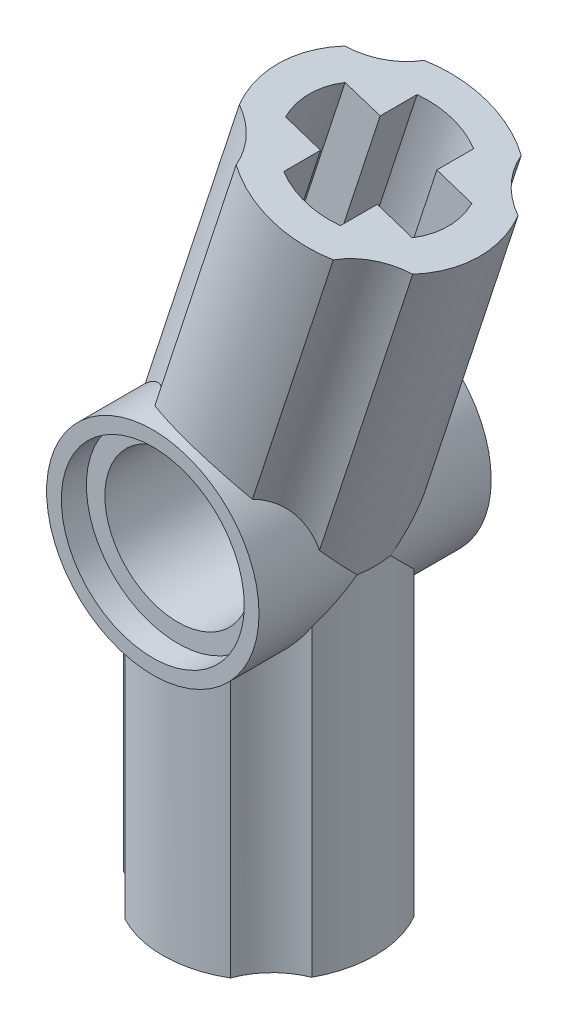
from build123d import *

# Parameters (mm, degrees)
CROQUIS1_R                   = 3.6
CROQUIS1_R_2                 = 3.1
SALIENTE_EXTRUIR1_DEPTH      = 7.87
SALIENTE_EXTRUIR2_START      = 0.85
CROQUIS1_3_R                 = 3.1
CROQUIS1_3_R_2               = 2.475
SALIENTE_EXTRUIR2_DEPTH      = 6.17
SALIENTE_EXTRUIR3_REACH      = 13.518
SALIENTE_EXTRUIR3_END_RADIUS = 3.6
SALIENTE_EXTRUIR4_START      = -8
SALIENTE_EXTRUIR4_DEPTH      = 8
SALIENTE_EXTRUIR5_REACH      = 20.306
SALIENTE_EXTRUIR5_END_RADIUS = 3.6
SALIENTE_EXTRUIR6_START      = -8
SALIENTE_EXTRUIR6_DEPTH      = 8


with BuildPart() as part:
    # Croquis1 → Saliente-Extruir1 (new body)
    with BuildSketch(Plane.XY):
        Circle(CROQUIS1_R)
        Circle(CROQUIS1_R_2, mode=Mode.SUBTRACT)
    extrude(amount=SALIENTE_EXTRUIR1_DEPTH)

    # Croquis1<3> → Saliente-Extruir2 (add)
    with BuildSketch(Plane.XY.offset(SALIENTE_EXTRUIR2_START)):
        Circle(CROQUIS1_3_R)
        Circle(CROQUIS1_3_R_2, mode=Mode.SUBTRACT)
    extrude(amount=SALIENTE_EXTRUIR2_DEPTH)

    # Saliente-Extruir3: up to this cylinder (the profile starts outside it)
    saliente_extruir3_end = Plane(origin=(0, 0, 6.19961), z_dir=(0, 0, -1)) * Cylinder(SALIENTE_EXTRUIR3_END_RADIUS, 35.236000000000004, mode=Mode.PRIVATE)
    # Croquis2 → Saliente-Extruir3 (add, up to the surface)
    with BuildSketch(Plane(origin=(0, -4, 0), x_dir=(1, 0, 0), z_dir=(0, 1, 0)), mode=Mode.PRIVATE) as saliente_extruir3_sk1:
        with BuildLine():
            ThreePointArc((-1.7124779696357202, -7.101610049171246), (0.05399392602494436, -7.534595068330939), (1.806684459564255, -7.048822612733265))
            ThreePointArc((1.806684459564255, -7.048822612733265), (2.337681630948243, -6.203587592595142), (3.1666100491712275, -5.647477969635754))
            ThreePointArc((3.1666100491712275, -5.647477969635754), (3.599595068330938, -3.881006073975069), (3.1138226127332604, -2.1283155404357355))
            ThreePointArc((3.1138226127332604, -2.1283155404357355), (2.268587592595135, -1.597318369051751), (1.7124779696357444, -0.7683899508287686))
            ThreePointArc((1.7124779696357444, -0.7683899508287686), (-0.0539939260249431, -0.3354049316690628), (-1.806684459564274, -0.8211773872667488))
            ThreePointArc((-1.806684459564274, -0.8211773872667488), (-2.337681630948256, -1.6664124074048765), (-3.166610049171237, -2.22252203036427))
            ThreePointArc((-3.166610049171237, -2.22252203036427), (-3.599595068330935, -3.9889939260249565), (-3.1138226127332462, -5.741684459564288))
            ThreePointArc((-3.1138226127332462, -5.741684459564288), (-2.268587592595116, -6.272681630948267), (-1.7124779696357202, -7.101610049171246))
        make_face()
        with BuildLine():
            Line((-1.01, -6.194540882568846), (-1.01, -4.944999999999999))
            Line((-1.01, -4.944999999999999), (-2.2595408825688463, -4.944999999999999))
            ThreePointArc((-2.2595408825688463, -4.944999999999999), (-2.475, -3.9349999999999996), (-2.2595408825688463, -2.9250000000000007))
            Line((-2.2595408825688463, -2.9250000000000007), (-1.01, -2.9250000000000007))
            Line((-1.01, -2.9250000000000007), (-1.01, -1.675459117431154))
            ThreePointArc((-1.01, -1.675459117431154), (1.5e-16, -1.4600000000000004), (1.01, -1.675459117431154))
            Line((1.01, -1.675459117431154), (1.01, -2.9250000000000007))
            Line((1.01, -2.9250000000000007), (2.2595408825688463, -2.9250000000000007))
            ThreePointArc((2.2595408825688463, -2.9250000000000007), (2.475, -3.935), (2.2595408825688463, -4.944999999999999))
            Line((2.2595408825688463, -4.944999999999999), (1.01, -4.944999999999999))
            Line((1.01, -4.944999999999999), (1.01, -6.194540882568846))
            ThreePointArc((1.01, -6.194540882568846), (1.5e-16, -6.41), (-1.01, -6.194540882568846))
        make_face(mode=Mode.SUBTRACT)
    saliente_extruir3_tool1 = extrude(saliente_extruir3_sk1.sketch, amount=SALIENTE_EXTRUIR3_REACH, mode=Mode.PRIVATE) - saliente_extruir3_end
    add(saliente_extruir3_tool1.solids().sort_by_distance((-2.197676, -4, 6.19961))[0])

    # Croquis2<3> → Saliente-Extruir4 (add)
    with BuildSketch(Plane(origin=(0, -4, 0), x_dir=(1, 0, 0), z_dir=(0, 1, 0)).offset(SALIENTE_EXTRUIR4_START)):
        with BuildLine():
            ThreePointArc((-3.166610049171237, -2.22252203036427), (-2.337681630948256, -1.6664124074048765), (-1.806684459564274, -0.8211773872667488))
            ThreePointArc((-1.806684459564274, -0.8211773872667488), (-0.0539939260249431, -0.3354049316690628), (1.7124779696357444, -0.7683899508287686))
            ThreePointArc((1.7124779696357444, -0.7683899508287686), (2.268587592595135, -1.597318369051751), (3.1138226127332604, -2.1283155404357355))
            ThreePointArc((3.1138226127332604, -2.1283155404357355), (3.599595068330938, -3.881006073975069), (3.1666100491712275, -5.647477969635754))
            ThreePointArc((3.1666100491712275, -5.647477969635754), (2.337681630948243, -6.203587592595142), (1.806684459564255, -7.048822612733265))
            ThreePointArc((1.806684459564255, -7.048822612733265), (0.05399392602494436, -7.534595068330939), (-1.7124779696357202, -7.101610049171246))
            ThreePointArc((-1.7124779696357202, -7.101610049171246), (-2.268587592595116, -6.272681630948267), (-3.1138226127332462, -5.741684459564288))
            ThreePointArc((-3.1138226127332462, -5.741684459564288), (-3.599595068330935, -3.9889939260249565), (-3.166610049171237, -2.22252203036427))
        make_face()
        with BuildLine():
            ThreePointArc((-2.2595408825688463, -2.9250000000000007), (-2.475, -3.9349999999999996), (-2.2595408825688463, -4.944999999999999))
            Line((-2.2595408825688463, -4.944999999999999), (-1.01, -4.944999999999999))
            Line((-1.01, -4.944999999999999), (-1.01, -6.194540882568846))
            ThreePointArc((-1.01, -6.194540882568846), (1.5e-16, -6.41), (1.01, -6.194540882568846))
            Line((1.01, -6.194540882568846), (1.01, -4.944999999999999))
            Line((1.01, -4.944999999999999), (2.2595408825688463, -4.944999999999999))
            ThreePointArc((2.2595408825688463, -4.944999999999999), (2.475, -3.935), (2.2595408825688463, -2.9250000000000007))
            Line((2.2595408825688463, -2.9250000000000007), (1.01, -2.9250000000000007))
            Line((1.01, -2.9250000000000007), (1.01, -1.675459117431154))
            ThreePointArc((1.01, -1.675459117431154), (1.5e-16, -1.4600000000000004), (-1.01, -1.675459117431154))
            Line((-1.01, -1.675459117431154), (-1.01, -2.9250000000000007))
            Line((-1.01, -2.9250000000000007), (-2.2595408825688463, -2.9250000000000007))
        make_face(mode=Mode.SUBTRACT)
    extrude(amount=SALIENTE_EXTRUIR4_DEPTH)

    # Saliente-Extruir5: up to this cylinder (the profile starts outside it)
    saliente_extruir5_end = Plane(origin=(0, 0, 3.935), z_dir=(0, 0, -1)) * Cylinder(SALIENTE_EXTRUIR5_END_RADIUS, 48.812000000000005, mode=Mode.PRIVATE)
    # Croquis7 → Saliente-Extruir5 (add, up to the surface)
    with BuildSketch(Plane(origin=(1.2407147927733873, 3.8027130844955015, 0), x_dir=(0, 0, 1), z_dir=(-0.31017869819334676, -0.9506782711238754, 0)), mode=Mode.PRIVATE) as saliente_extruir5_sk1:
        with BuildLine():
            ThreePointArc((2.222522030364279, -3.1666100491712452), (3.9889939260249445, -3.5995950683309377), (5.741684459564254, -3.113822612733264))
            ThreePointArc((5.741684459564254, -3.113822612733264), (6.272681630948287, -2.2685875925951686), (7.101610049171227, -1.7124779696357533))
            ThreePointArc((7.101610049171227, -1.7124779696357533), (7.534595068330938, 0.0539939260249318), (7.048822612733259, 1.8066844595642648))
            ThreePointArc((7.048822612733259, 1.8066844595642648), (6.203587592595132, 2.337681630948248), (5.647477969635745, 3.1666100491712332))
            ThreePointArc((5.647477969635745, 3.1666100491712332), (3.881006073975058, 3.599595068330939), (2.1283155404357252, 3.113822612733254))
            ThreePointArc((2.1283155404357252, 3.113822612733254), (1.5973183690517558, 2.268587592595114), (0.7683899508287607, 1.7124779696357326))
            ThreePointArc((0.7683899508287607, 1.7124779696357326), (0.33540493166906193, -0.05399392602495561), (0.8211773872667536, -1.8066844595642866))
            ThreePointArc((0.8211773872667536, -1.8066844595642866), (1.6664124074048823, -2.337681630948267), (2.222522030364279, -3.1666100491712452))
        make_face()
    saliente_extruir5_tool1 = extrude(saliente_extruir5_sk1.sketch, amount=SALIENTE_EXTRUIR5_REACH, mode=Mode.PRIVATE) - saliente_extruir5_end
    add(saliente_extruir5_tool1.solids().sort_by_distance((1.240715, 3.802713, 3.935))[0])

    # Croquis7<3> → Saliente-Extruir6 (add)
    with BuildSketch(Plane(origin=(1.2407147927733873, 3.8027130844955015, 0), x_dir=(0, 0, 1), z_dir=(-0.31017869819334676, -0.9506782711238754, 0)).offset(SALIENTE_EXTRUIR6_START)):
        with BuildLine():
            ThreePointArc((0.7683899508287607, 1.7124779696357326), (1.5973183690517558, 2.268587592595114), (2.1283155404357252, 3.113822612733254))
            ThreePointArc((2.1283155404357252, 3.113822612733254), (3.881006073975058, 3.599595068330939), (5.647477969635745, 3.1666100491712332))
            ThreePointArc((5.647477969635745, 3.1666100491712332), (6.203587592595132, 2.337681630948248), (7.048822612733259, 1.8066844595642648))
            ThreePointArc((7.048822612733259, 1.8066844595642648), (7.534595068330938, 0.0539939260249318), (7.101610049171227, -1.7124779696357533))
            ThreePointArc((7.101610049171227, -1.7124779696357533), (6.272681630948287, -2.2685875925951686), (5.741684459564254, -3.113822612733264))
            ThreePointArc((5.741684459564254, -3.113822612733264), (3.9889939260249445, -3.5995950683309377), (2.222522030364279, -3.1666100491712452))
            ThreePointArc((2.222522030364279, -3.1666100491712452), (1.6664124074048823, -2.337681630948267), (0.8211773872667536, -1.8066844595642866))
            ThreePointArc((0.8211773872667536, -1.8066844595642866), (0.33540493166906193, -0.05399392602495561), (0.7683899508287607, 1.7124779696357326))
        make_face()
        with BuildLine():
            ThreePointArc((1.675459117431154, 1.010000000000001), (1.4600000000000004, 1.17e-15), (1.675459117431154, -1.0099999999999991))
            Line((1.675459117431154, -1.0099999999999991), (2.925, -1.0099999999999991))
            Line((2.925, -1.0099999999999991), (2.925, -2.2595408825688454))
            ThreePointArc((2.925, -2.2595408825688454), (3.934999999999999, -2.474999999999999), (4.944999999999999, -2.259540882568846))
            Line((4.944999999999999, -2.259540882568846), (4.944999999999999, -1.009999999999999))
            Line((4.944999999999999, -1.009999999999999), (6.194540882568846, -1.0099999999999987))
            ThreePointArc((6.194540882568846, -1.0099999999999987), (6.41, 1e-15), (6.194540882568846, 1.010000000000001))
            Line((6.194540882568846, 1.010000000000001), (4.944999999999999, 1.010000000000001))
            Line((4.944999999999999, 1.010000000000001), (4.944999999999999, 2.259540882568847))
            ThreePointArc((4.944999999999999, 2.259540882568847), (3.9349999999999996, 2.475000000000001), (2.925, 2.2595408825688468))
            Line((2.925, 2.2595408825688468), (2.925, 1.010000000000001))
            Line((2.925, 1.010000000000001), (1.675459117431154, 1.010000000000001))
        make_face(mode=Mode.SUBTRACT)
    extrude(amount=SALIENTE_EXTRUIR6_DEPTH)


solid = part.part
